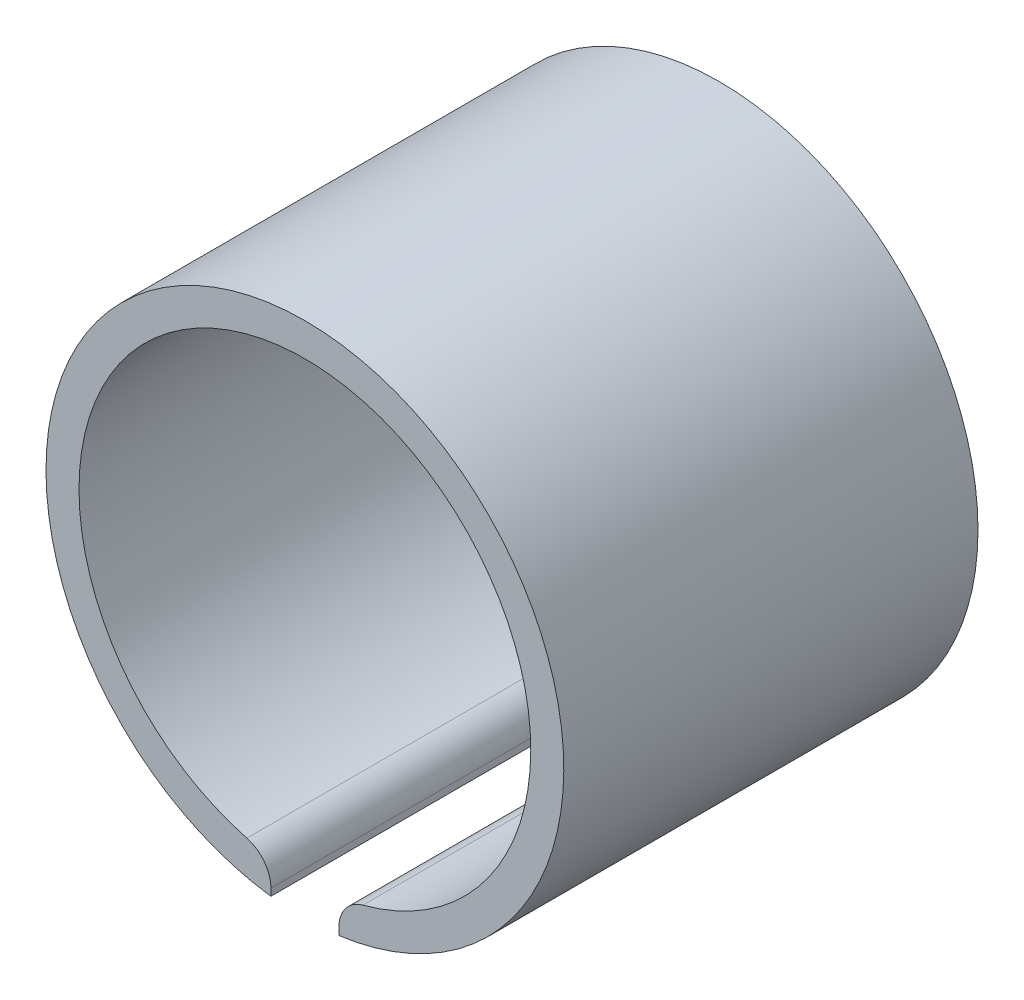
from build123d import *

# Parameters (mm, degrees)
SKETCH1_R           = 20
SKETCH1_R_2         = 5
BOSS_EXTRUDE1_DEPTH = 2
BOSS_EXTRUDE2_DEPTH = 30
FILLET1_R           = 2.5


with BuildPart() as part:
    # Sketch1 → Boss-Extrude1 (new body)
    with BuildSketch(Plane.XY):
        Circle(SKETCH1_R)
        Circle(SKETCH1_R_2, mode=Mode.SUBTRACT)
    extrude(amount=BOSS_EXTRUDE1_DEPTH)

    # Sketch2 → Boss-Extrude2 (add)
    with BuildSketch(Plane.XY.offset(2)):
        with BuildLine():
            Line((-2.625, -19.826986029), (-2.625, -17.2514311))
            ThreePointArc((-2.625, -17.2514311), (-11.373131715, 13.234590096), (17.45, 0))
            ThreePointArc((17.45, 0), (13.234590096, -11.373131715), (2.625, -17.2514311))
            Line((2.625, -17.2514311), (2.625, -19.826986029))
            ThreePointArc((2.625, -19.826986029), (15.041608956, -13.181426326), (20, 0))
            ThreePointArc((20, 0), (-13.181426326, 15.041608956), (-2.625, -19.826986029))
        make_face()
    extrude(amount=BOSS_EXTRUDE2_DEPTH)

    # Fillet1
    fillet1_edges = [part.edges().sort_by_distance(p)[0] for p in [
        (-2.625, -17.2514311, 17),
        (2.625, -17.2514311, 17),
    ]]
    fillet(fillet1_edges, radius=FILLET1_R)


solid = part.part
